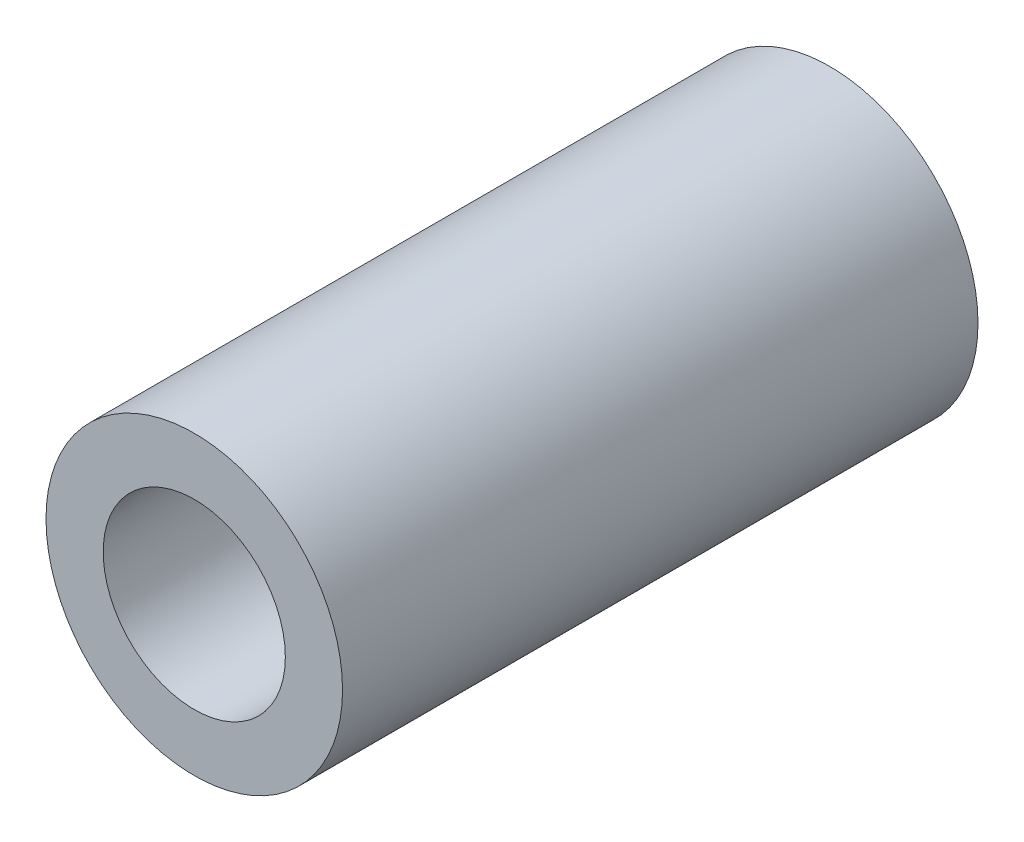
from build123d import *

# Parameters (mm, degrees)
SKETCH_1_R      = 3.5
SKETCH_1_R_2    = 2.15
EXTRUDE_1_DEPTH = 15


with BuildPart() as part:
    # Эскиз1 → Бобышка-Вытянуть1 (new body)
    with BuildSketch(Plane.XY):
        Circle(SKETCH_1_R)
        Circle(SKETCH_1_R_2, mode=Mode.SUBTRACT)
    extrude(amount=EXTRUDE_1_DEPTH)


solid = part.part
